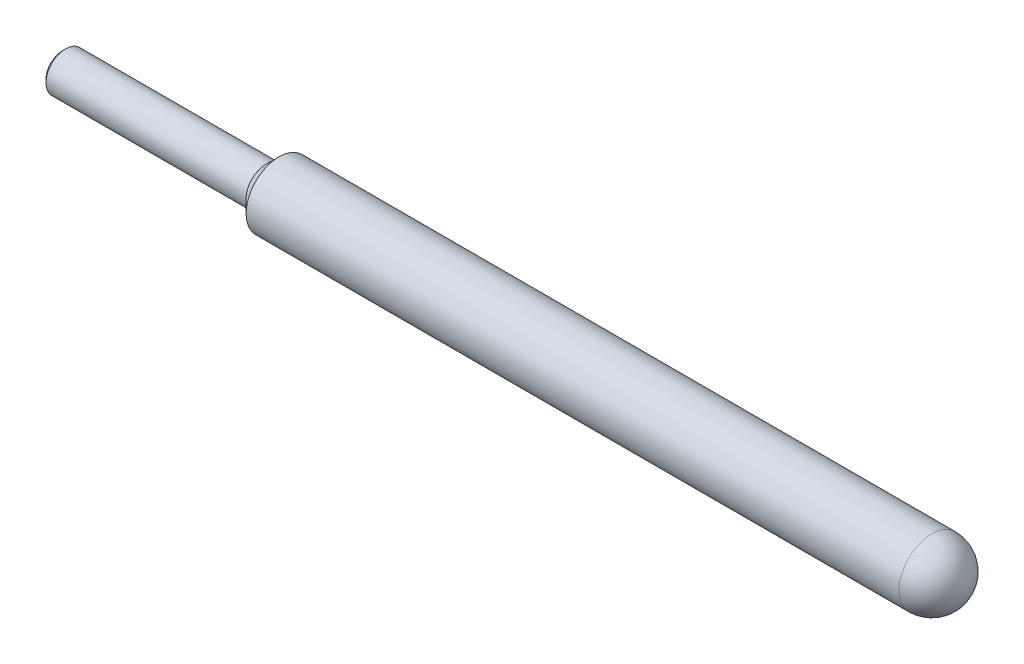
from build123d import *

# Parameters (mm, degrees)
FILLET1_R     = 10
CHAMFER1_SIZE = 1


with BuildPart() as part:
    # Sketch1 → Revolve1 (revolve)
    with BuildSketch(Plane.XY, mode=Mode.PRIVATE) as revolve1_sk:
        Polygon((-137.5, 0), (137.5, 0), (137.5, 10), (-71.5, 10), (-75.5, 6), (-137.5, 6), align=None)
    revolve(revolve1_sk.sketch.rotate(Axis((-137.5, 0, 0), (1, 0, 0)), 90), axis=Axis((-137.5, 0, 0), (1, 0, 0)))

    # Fillet1
    fillet1_edges = [part.edges().sort_by_distance(p)[0] for p in [
        (137.5, 0, -10),
    ]]
    fillet(fillet1_edges, radius=FILLET1_R)

    # Chamfer1
    chamfer1_edges = [part.edges().sort_by_distance(p)[0] for p in [
        (-137.5, 0, -6),
    ]]
    chamfer(chamfer1_edges, length=CHAMFER1_SIZE)


solid = part.part
